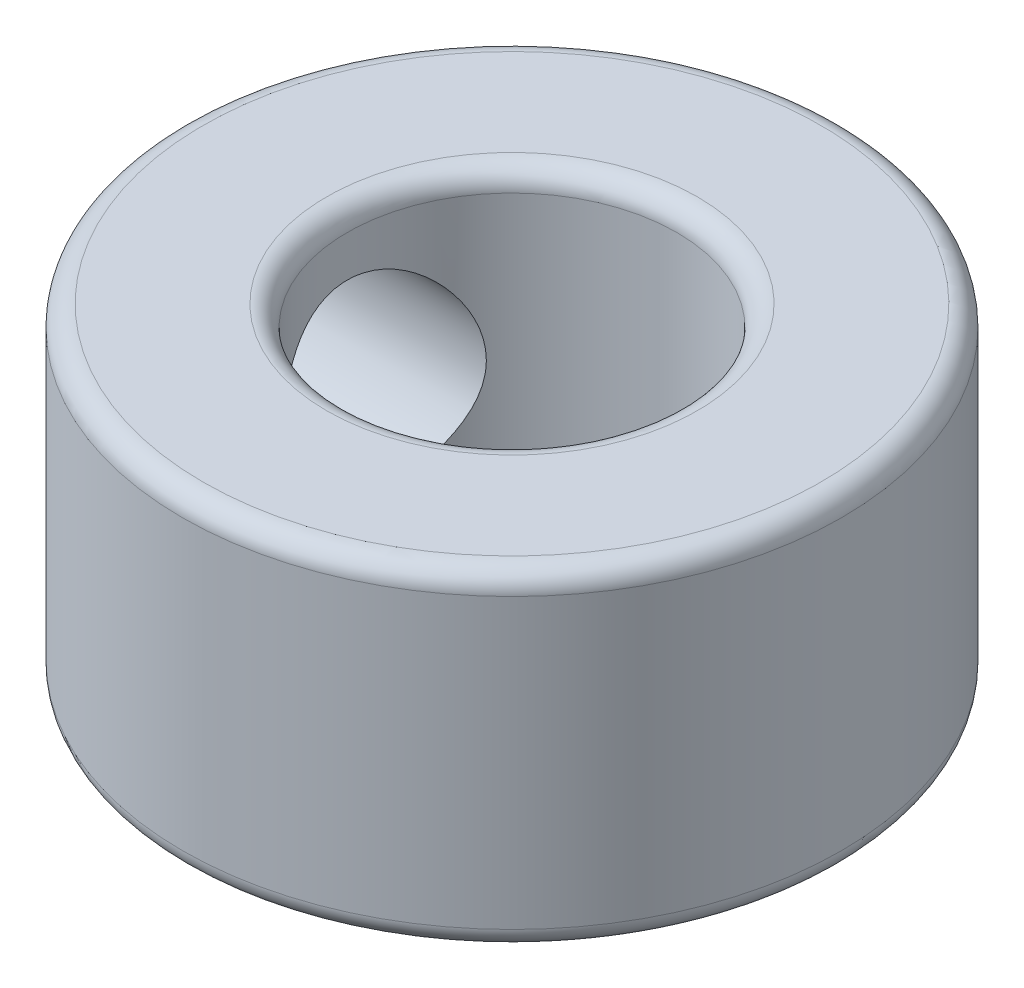
from build123d import *

# Parameters (mm, degrees)
SKETCH1_R           = 8
SKETCH1_R_2         = 4
BOSS_EXTRUDE1_DEPTH = 8
SKETCH4_R           = 2.5
CUT_EXTRUDE1_DEPTH  = 8
FILLET1_R           = 0.5


with BuildPart() as part:
    # Sketch1 → Boss-Extrude1 (new body)
    with BuildSketch(Plane(origin=(0, 0, 0), x_dir=(1, 0, 0), z_dir=(0, 1, 0))):
        with Locations(Location((0, 0, 0), (0, 0, 270))):
            Circle(SKETCH1_R)
        with Locations(Location((0, 0, 0), (0, 0, 270))):
            Circle(SKETCH1_R_2, mode=Mode.SUBTRACT)
    extrude(amount=BOSS_EXTRUDE1_DEPTH)

    # Sketch4 → Cut-Extrude1 (cut)
    with BuildSketch(Plane(origin=(0, 0, 0), x_dir=(0, 0, -1), z_dir=(1, 0, 0))):
        with Locations((0, 4)):
            Circle(SKETCH4_R)
    extrude(amount=-CUT_EXTRUDE1_DEPTH, mode=Mode.SUBTRACT)

    # Fillet1
    fillet1_edges = [part.edges().sort_by_distance(p)[0] for p in [
        (0, 0, -8),
        (0, 8, -8),
        (0, 0, -4),
        (0, 8, -4),
    ]]
    fillet(fillet1_edges, radius=FILLET1_R)


solid = part.part
